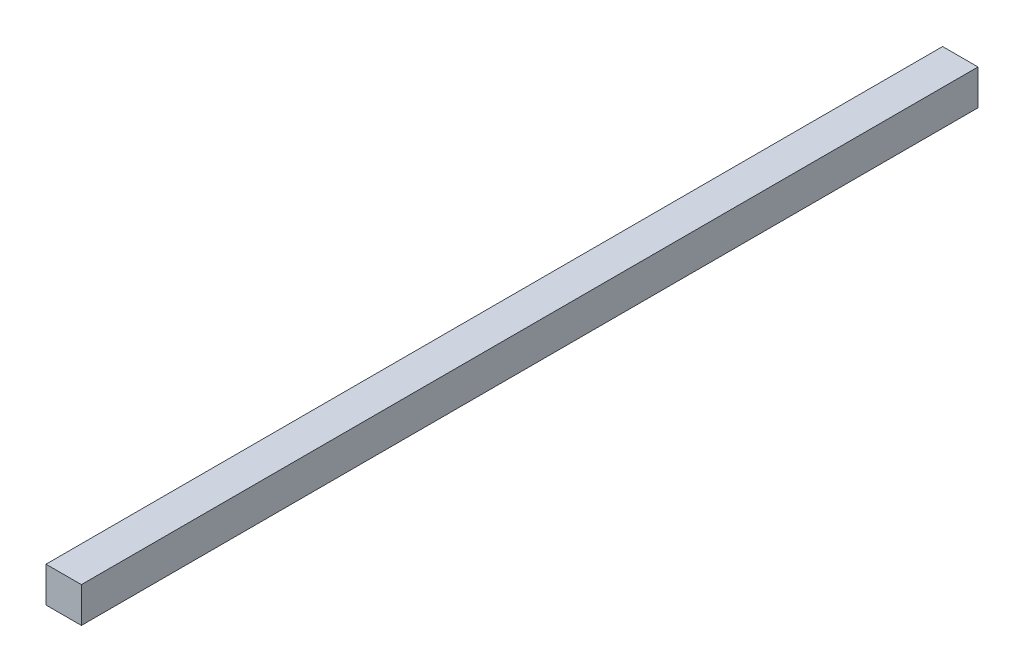
from build123d import *

# Parameters (mm, degrees)
SKETCH1_W           = 456
SKETCH1_H           = 18
BOSS_EXTRUDE1_DEPTH = 18


with BuildPart() as part:
    # Sketch1 → Boss-Extrude1 (new body)
    with BuildSketch(Plane(origin=(0, 0, 0), x_dir=(0, 0, -1), z_dir=(1, 0, 0))):
        with Locations((228, 9)):
            Rectangle(SKETCH1_W, SKETCH1_H)
    extrude(amount=BOSS_EXTRUDE1_DEPTH)


solid = part.part
